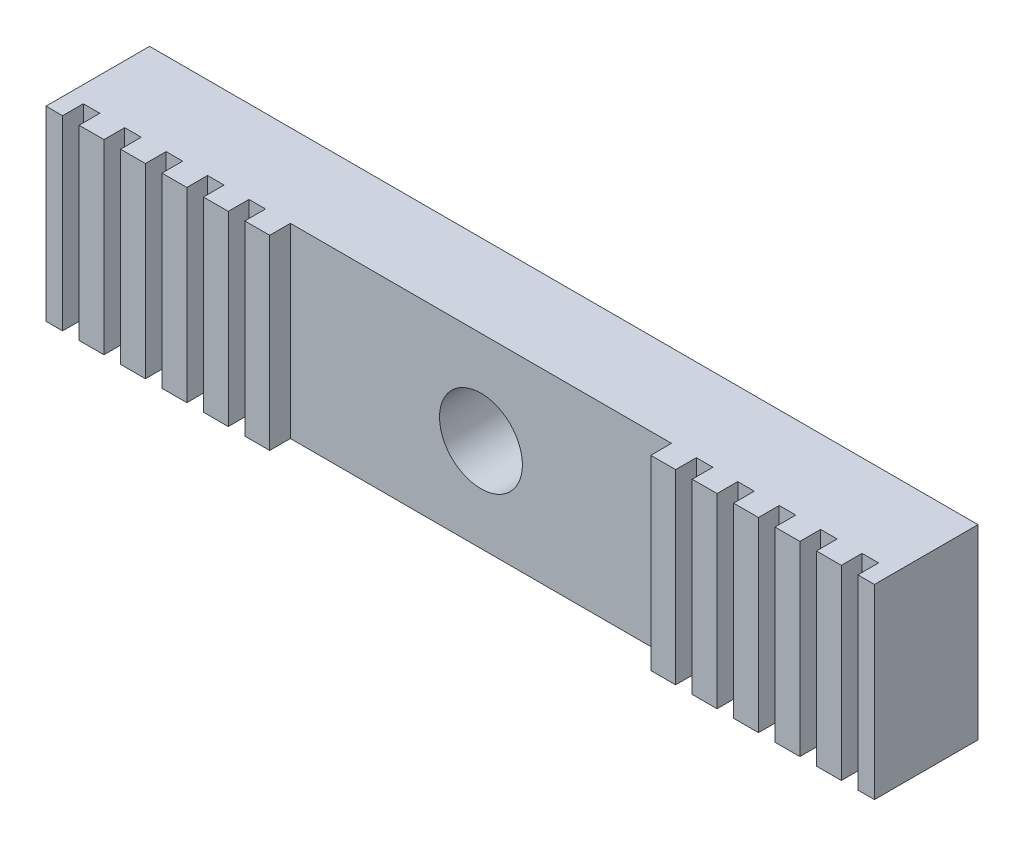
from build123d import *

# Parameters (mm, degrees)
SKETCH_1_W          = 40
SKETCH_1_H          = 9
SKETCH_1_R          = 2
EXTRUDE_1_DEPTH     = 5
SKETCH_2_W          = 0.8
SKETCH_2_H          = 1
CUT_EXTRUDE_1_DEPTH = 23.494443758


with BuildPart() as part:
    # 草圖1 → 填料-伸長1 (new body)
    with BuildSketch(Plane.XY):
        Rectangle(SKETCH_1_W, SKETCH_1_H)
        Circle(SKETCH_1_R, mode=Mode.SUBTRACT)
    extrude(amount=EXTRUDE_1_DEPTH)

    # 草圖2 → 除料-伸長1 (cut, through all)
    with BuildSketch(Plane.XZ.offset(4.5)):
        with Locations((-18.8, 4.5)):
            Rectangle(SKETCH_2_W, SKETCH_2_H)
        with Locations((-16.8, 4.5)):
            Rectangle(SKETCH_2_W, SKETCH_2_H)
        with Locations((-14.8, 4.5)):
            Rectangle(SKETCH_2_W, SKETCH_2_H)
        with Locations((-12.8, 4.5)):
            Rectangle(SKETCH_2_W, SKETCH_2_H)
        with Locations((-10.8, 4.5)):
            Rectangle(SKETCH_2_W, SKETCH_2_H)
        Polygon((-9.2, 4), (-8.4, 4), (8.4, 4), (9.2, 4), (9.2, 5), (8.4, 5), (-8.4, 5), (-9.2, 5), align=None)
        with Locations((10.8, 4.5)):
            Rectangle(SKETCH_2_W, SKETCH_2_H)
        with Locations((12.8, 4.5)):
            Rectangle(SKETCH_2_W, SKETCH_2_H)
        with Locations((14.8, 4.5)):
            Rectangle(SKETCH_2_W, SKETCH_2_H)
        with Locations((16.8, 4.5)):
            Rectangle(SKETCH_2_W, SKETCH_2_H)
        with Locations((18.8, 4.5)):
            Rectangle(SKETCH_2_W, SKETCH_2_H)
    extrude(amount=-CUT_EXTRUDE_1_DEPTH, mode=Mode.SUBTRACT)


solid = part.part
